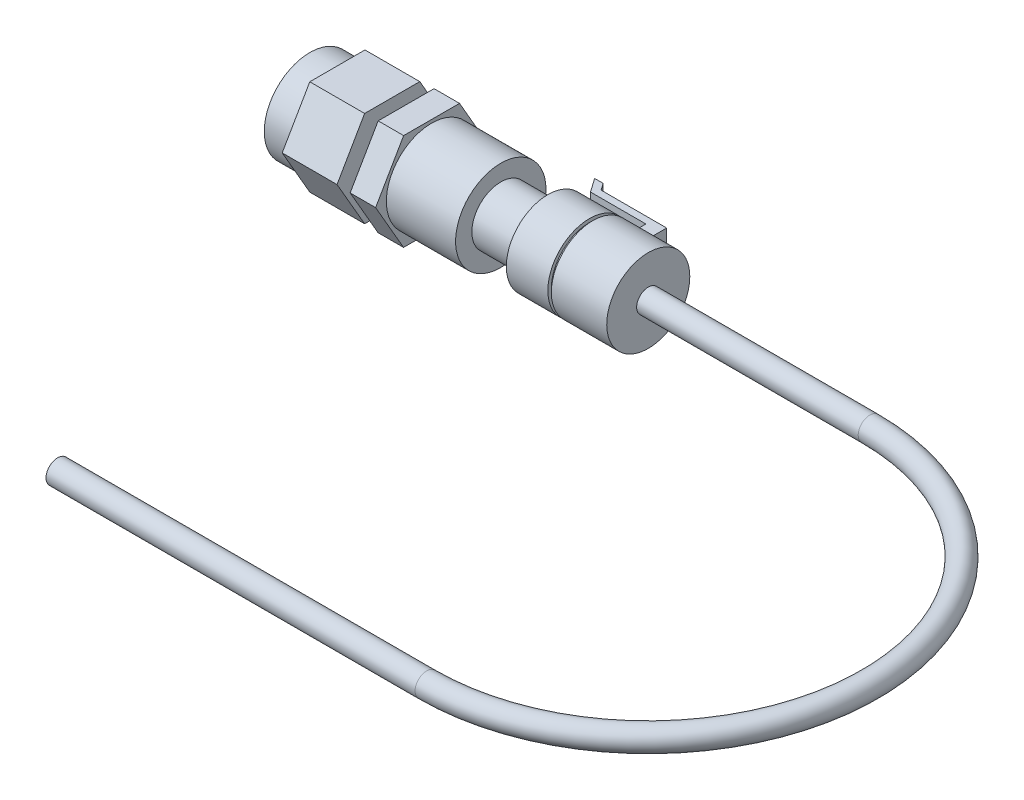
from build123d import *

# Parameters (mm, degrees)
SKETCH1_R            = 10.3632
BOSS_EXTRUDE1_DEPTH  = 15.875
BOSS_EXTRUDE2_DEPTH  = 5.842
SKETCH3_R            = 3.131421561
BOSS_EXTRUDE3_DEPTH  = 3.175
BOSS_EXTRUDE4_DEPTH  = 12.573
SKETCH5_R            = 10.4775
BOSS_EXTRUDE5_DEPTH  = 6.2865
SKETCH6_R            = 6.63575
BOSS_EXTRUDE6_DEPTH  = 10.795
SKETCH7_R            = 9.525
BOSS_EXTRUDE7_DEPTH  = 9.525
SKETCH9_R            = 8.7376
BOSS_EXTRUDE8_DEPTH  = 0.79375
SKETCH10_R           = 9.525
BOSS_EXTRUDE9_DEPTH  = 12.7
CUT_EXTRUDE1_DEPTH   = 1.5875
CUT_EXTRUDE2_REACH   = 51.292
SKETCH12_W           = 3.175
SKETCH12_H           = 3.175
BOSS_EXTRUDE10_DEPTH = 6.35
SKETCH13_W           = 1.5875
SKETCH13_H           = 3.175
BOSS_EXTRUDE11_DEPTH = 12.7
BOSS_EXTRUDE12_DEPTH = 3.175
BOSS_EXTRUDE13_DEPTH = 3.175
SKETCH17_W           = 1.953483497
SKETCH17_H           = 9.525
BOSS_EXTRUDE14_DEPTH = 1.5875
CUT_EXTRUDE3_REACH   = 50.413
SKETCH21_R           = 2.667
SKETCH22_R           = 2.54
CUT_EXTRUDE4_DEPTH   = 27.94


with BuildPart() as part:
    # Sketch1 → Boss-Extrude1 (new body)
    with BuildSketch(Plane(origin=(0, 0, 0), x_dir=(0, 0, -1), z_dir=(1, 0, 0))):
        Circle(SKETCH1_R)
    extrude(amount=-BOSS_EXTRUDE1_DEPTH)

    # Sketch2 → Boss-Extrude2 (add)
    with BuildSketch(Plane.ZY.offset(15.875)):
        Polygon((6.397302804, 11.106241349), (-6.419635747, 11.093347418), (-12.81693855, -0.012893931), (-6.397302804, -11.106241349), (6.419635747, -11.093347418), (12.81693855, 0.012893931), align=None)
    extrude(amount=BOSS_EXTRUDE2_DEPTH)

    # Sketch3 → Boss-Extrude3 (add)
    with BuildSketch(Plane.ZY.offset(21.717)):
        Circle(SKETCH3_R)
    extrude(amount=BOSS_EXTRUDE3_DEPTH)

    # Sketch4 → Boss-Extrude4 (add)
    with BuildSketch(Plane.ZY.offset(24.892)):
        Polygon((-12.648301022, 0), (-6.324150511, -10.95375), (6.324150511, -10.95375), (12.648301022, 0), (6.324150511, 10.95375), (-6.324150511, 10.95375), align=None)
    extrude(amount=BOSS_EXTRUDE4_DEPTH)

    # Sketch5 → Boss-Extrude5 (add)
    with BuildSketch(Plane.ZY.offset(37.465)):
        Circle(SKETCH5_R)
    extrude(amount=BOSS_EXTRUDE5_DEPTH)

    # Sketch6 → Boss-Extrude6 (add)
    with BuildSketch(Plane(origin=(0, 0, 0), x_dir=(0, 0, -1), z_dir=(1, 0, 0))):
        Circle(SKETCH6_R)
    extrude(amount=BOSS_EXTRUDE6_DEPTH)

    # Sketch7 → Boss-Extrude7 (add)
    with BuildSketch(Plane(origin=(10.795, 0, 0), x_dir=(0, 0, -1), z_dir=(1, 0, 0))):
        Circle(SKETCH7_R)
    extrude(amount=BOSS_EXTRUDE7_DEPTH)

    # Sketch9 → Boss-Extrude8 (add)
    with BuildSketch(Plane(origin=(20.32, 0, 0), x_dir=(0, 0, -1), z_dir=(1, 0, 0))):
        Circle(SKETCH9_R)
    extrude(amount=BOSS_EXTRUDE8_DEPTH)

    # Sketch10 → Boss-Extrude9 (add)
    with BuildSketch(Plane(origin=(21.11375, 0, 0), x_dir=(0, 0, -1), z_dir=(1, 0, 0))):
        Circle(SKETCH10_R)
    extrude(amount=BOSS_EXTRUDE9_DEPTH)

    # Sketch11 → Cut-Extrude1 (cut)
    with BuildSketch(Plane.XY.offset(-6.985)):
        Polygon((27.46375, 5.844282471), (27.46375, -5.844282471), (20.32, -5.844282471), (20.32, -1.410545514), (23.495, -1.410545514), (23.495, 1.410545514), (20.32, 1.410545514), (20.32, 5.844282471), align=None)
    extrude(amount=CUT_EXTRUDE1_DEPTH, mode=Mode.SUBTRACT)

    # Sketch11<2> → Cut-Extrude2 (cut, up to next)
    with BuildSketch(Plane.XY.offset(-6.985), mode=Mode.PRIVATE) as cut_extrude2_sk1:
        Polygon((27.46375, 5.844282471), (27.46375, -5.844282471), (20.32, -5.844282471), (20.32, -1.410545514), (23.495, -1.410545514), (23.495, 1.410545514), (20.32, 1.410545514), (20.32, 5.844282471), align=None)
    cut_extrude2_tool1 = extrude(cut_extrude2_sk1.sketch, amount=-CUT_EXTRUDE2_REACH, mode=Mode.PRIVATE) & part.part
    add(cut_extrude2_tool1.solids().sort_by_distance((24.130314, 0, -6.985))[0], mode=Mode.SUBTRACT)

    # Sketch12 → Boss-Extrude10 (add)
    with BuildSketch(Plane(origin=(0, 0, -5.3975), x_dir=(-1, 0, 0), z_dir=(0, 0, -1))):
        with Locations((-24.69818991, -3.175)):
            Rectangle(SKETCH12_W, SKETCH12_H)
        with Locations((-24.69818991, 3.175)):
            Rectangle(SKETCH12_W, SKETCH12_H)
    extrude(amount=BOSS_EXTRUDE10_DEPTH)

    # Sketch13 → Boss-Extrude11 (add)
    with BuildSketch(Plane.ZY.offset(-23.11068991)):
        with Locations((-10.95375, -3.175)):
            Rectangle(SKETCH13_W, SKETCH13_H)
        with Locations((-10.95375, 3.175)):
            Rectangle(SKETCH13_W, SKETCH13_H)
    extrude(amount=BOSS_EXTRUDE11_DEPTH)

    # Sketch14 → Boss-Extrude12 (add)
    with BuildSketch(Plane.XZ.offset(4.7625)):
        Polygon((12.364173407, -10.16), (10.141014473, -13.335), (8.187530976, -13.335), (10.41068991, -10.16), align=None)
    extrude(amount=-BOSS_EXTRUDE12_DEPTH)

    # Sketch16 → Boss-Extrude13 (add)
    with BuildSketch(Plane(origin=(0, 4.7625, 0), x_dir=(1, 0, 0), z_dir=(0, 1, 0))):
        Polygon((10.41068991, 10.16), (8.187530976, 13.335), (10.141014473, 13.335), (12.364173407, 10.16), align=None)
    extrude(amount=-BOSS_EXTRUDE13_DEPTH)

    # Sketch17 → Boss-Extrude14 (add)
    with BuildSketch(Plane(origin=(0, 0, -13.335), x_dir=(-1, 0, 0), z_dir=(0, 0, -1))):
        with Locations((-9.164272724, 0)):
            Rectangle(SKETCH17_W, SKETCH17_H)
    extrude(amount=-BOSS_EXTRUDE14_DEPTH)

    # Sketch18 → Cut-Extrude3 (cut, up to next)
    with BuildSketch(Plane(origin=(0, 4.7625, 0), x_dir=(1, 0, 0), z_dir=(0, 1, 0)), mode=Mode.PRIVATE) as cut_extrude3_sk1:
        Polygon((10.41068991, 10.16), (8.187530976, 13.335), (8.187530976, 10.16), align=None)
    cut_extrude3_tool1 = extrude(cut_extrude3_sk1.sketch, amount=-CUT_EXTRUDE3_REACH, mode=Mode.PRIVATE) & part.part
    add(cut_extrude3_tool1.solids().sort_by_distance((8.928584, 4.7625, -11.218333))[0], mode=Mode.SUBTRACT)

    # Sweep1: sweep along a path in Sketch19
    with BuildLine(Plane(origin=(0, 0, 0), x_dir=(1, 0, 0), z_dir=(0, 1, 0))) as sweep1_path:
        Line((33.81375, 0), (84.61375, 0))
        ThreePointArc((84.61375, 0), (135.41375, -50.8), (84.61375, -101.6))
        Line((84.61375, -101.6), (0, -101.6))
    # Sketch21 → Sweep1 (sweep)
    with BuildSketch(Plane(origin=(0, 0, 0), x_dir=(0, 0, -1), z_dir=(1, 0, 0))):
        with Locations((-101.6, 0)):
            Circle(SKETCH21_R)
    sweep(path=sweep1_path.line)

    # Sketch22 → Cut-Extrude4 (cut)
    with BuildSketch(Plane.ZY.offset(43.7515)):
        Circle(SKETCH22_R)
    extrude(amount=-CUT_EXTRUDE4_DEPTH, mode=Mode.SUBTRACT)


solid = part.part
